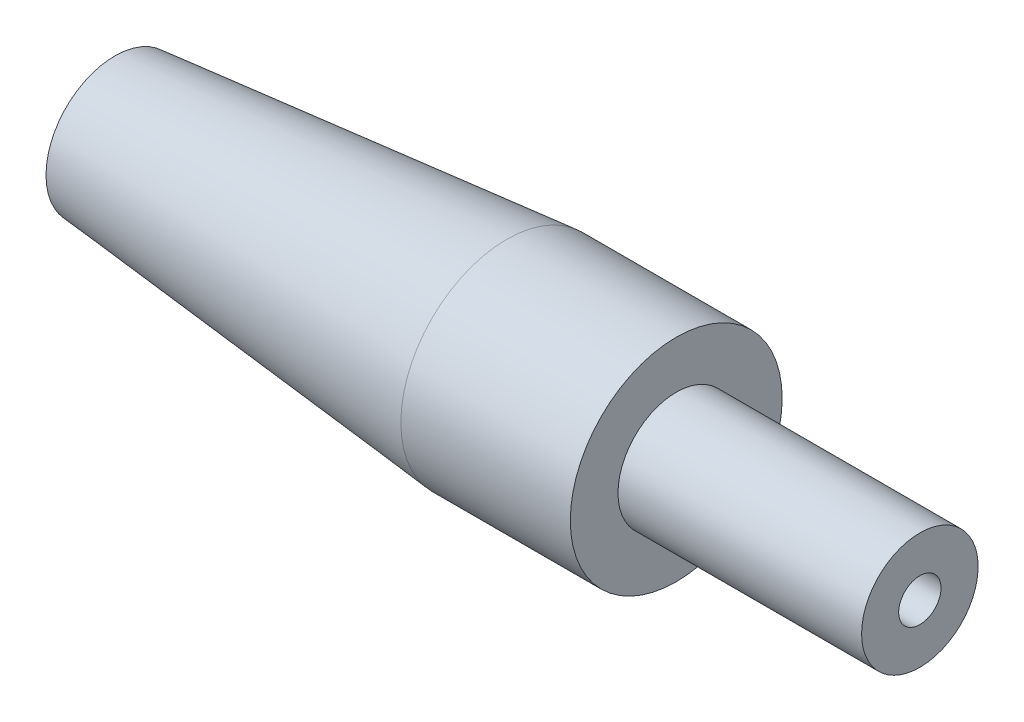
from build123d import *

# Parameters (mm, degrees)
SKETCH_2_R          = 1
CUT_EXTRUDE_1_DEPTH = 8


with BuildPart() as part:
    # 草图1 → 旋转2 (revolve)
    with BuildSketch(Plane(origin=(0, 0, 0), x_dir=(1, 0, 0), z_dir=(0, 1, 0)), mode=Mode.PRIVATE) as revolve_2_sk:
        Polygon((11.5, 0), (11.5, 2.75), (0, 2.75), (0, 5), (-8, 5), (-26.5, 3.25), (-26.5, 0), align=None)
    revolve(revolve_2_sk.sketch.rotate(Axis((-52.597365488, 0, 0), (1, 0, 0)), 180), axis=Axis((-52.597365488, 0, 0), (1, 0, 0)))

    # 草图2 → 切除-拉伸1 (cut)
    with BuildSketch(Plane(origin=(11.5, 0, 0), x_dir=(0, 0, -1), z_dir=(1, 0, 0))):
        Circle(SKETCH_2_R)
    extrude(amount=-CUT_EXTRUDE_1_DEPTH, mode=Mode.SUBTRACT)


solid = part.part
